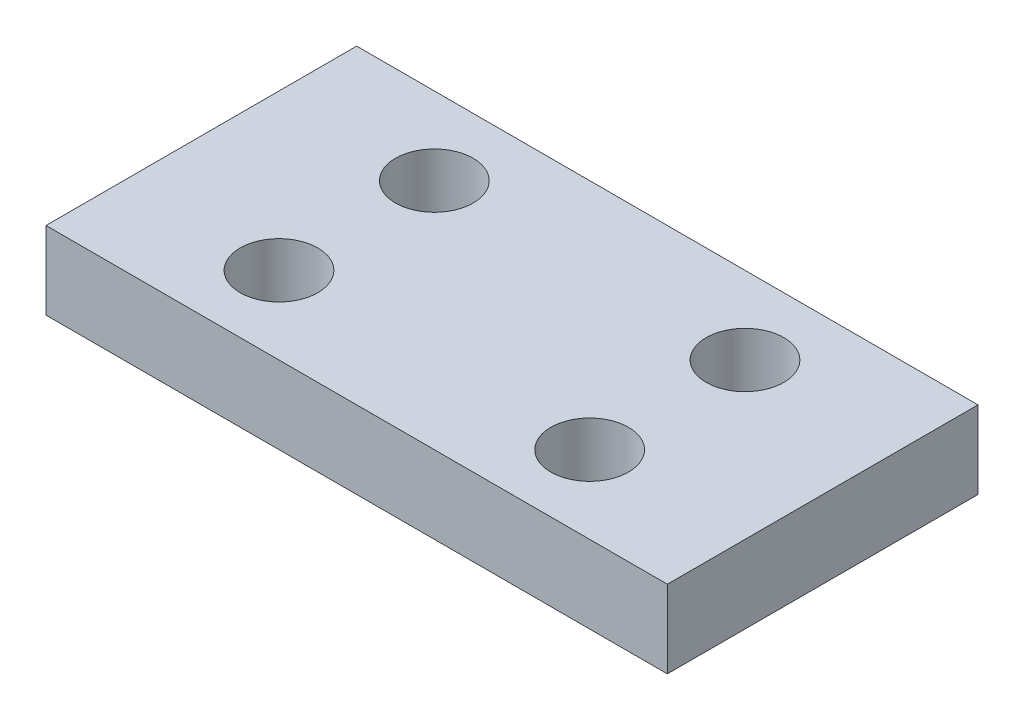
from build123d import *

# Parameters (mm, degrees)
SKETCH1_W           = 25.4
SKETCH1_H           = 12.7
SKETCH1_R           = 1.5875
BOSS_EXTRUDE1_DEPTH = 3.175


with BuildPart() as part:
    # Sketch1 → Boss-Extrude1 (new body)
    with BuildSketch(Plane(origin=(0, 0, 0), x_dir=(1, 0, 0), z_dir=(0, 1, 0))):
        Rectangle(SKETCH1_W, SKETCH1_H)
        with Locations(Location((6.35, 3.175, 0), (0, 0, 270))):
            Circle(SKETCH1_R, mode=Mode.SUBTRACT)
        with Locations(Location((-6.35, 3.175, 0), (0, 0, 90))):
            Circle(SKETCH1_R, mode=Mode.SUBTRACT)
        with Locations(Location((-6.35, -3.175, 0), (0, 0, 270))):
            Circle(SKETCH1_R, mode=Mode.SUBTRACT)
        with Locations(Location((6.35, -3.175, 0), (0, 0, 90))):
            Circle(SKETCH1_R, mode=Mode.SUBTRACT)
    extrude(amount=BOSS_EXTRUDE1_DEPTH)


solid = part.part
